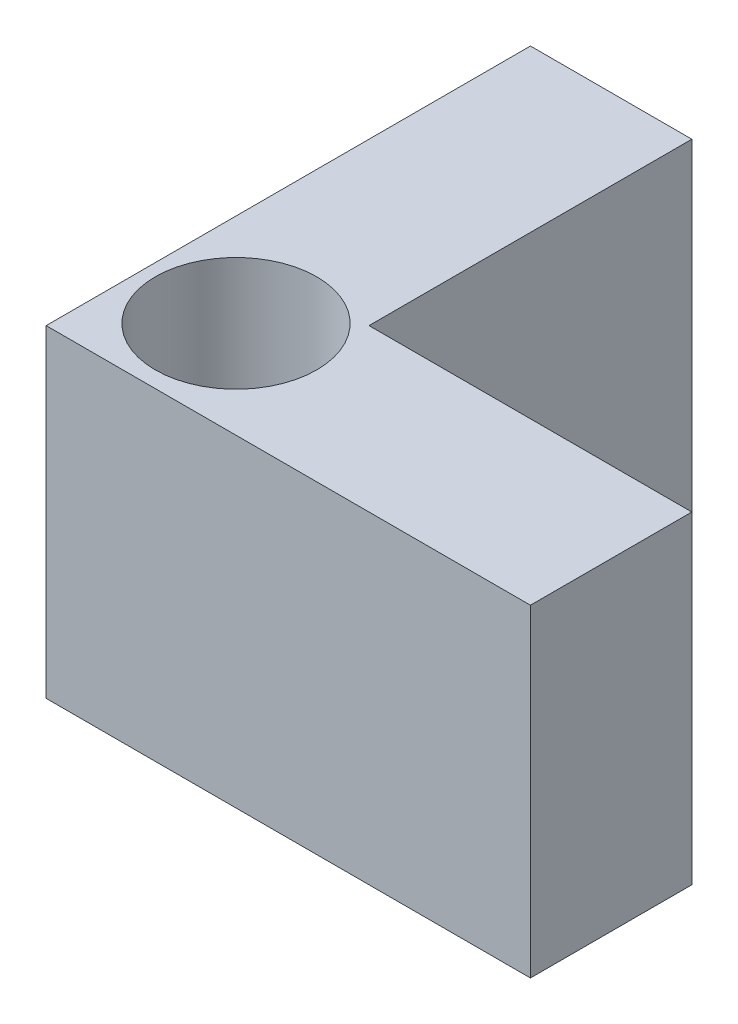
from build123d import *

# Parameters (mm, degrees)
SKETCH1_R           = 2.5
BOSS_EXTRUDE1_DEPTH = 10


with BuildPart() as part:
    # Sketch1 → Boss-Extrude1 (new body)
    with BuildSketch(Plane(origin=(0, 0, 0), x_dir=(1, 0, 0), z_dir=(0, 1, 0))):
        Polygon((0, 15), (0, 0), (15, 0), (15, 5), (5, 5), (5, 15), align=None)
        with Locations(Location((2.879948547, 3.000793191, 0), (0, 0, 270))):
            Circle(SKETCH1_R, mode=Mode.SUBTRACT)
    extrude(amount=BOSS_EXTRUDE1_DEPTH)


solid = part.part
